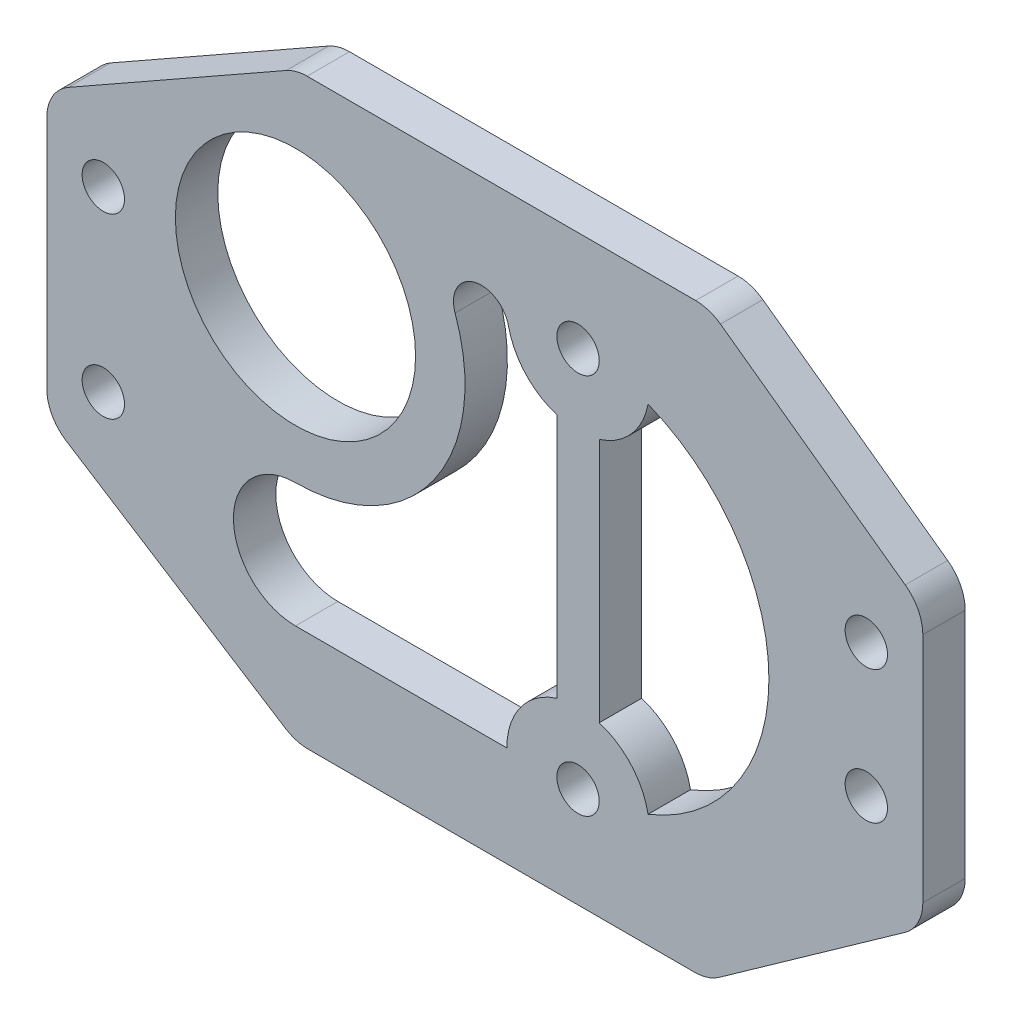
from build123d import *

# Parameters (mm, degrees)
SKETCH1_R           = 1.5
SKETCH1_R_2         = 8.5
BOSS_EXTRUDE1_DEPTH = 3


with BuildPart() as part:
    # Sketch1 → Boss-Extrude1 (new body)
    with BuildSketch(Plane.XY):
        with BuildLine():
            Line((0, 1.64796966), (0, 18.25796966))
            ThreePointArc((0, 18.25796966), (0.407702513, 19.767934474), (1.519995827, 20.867488322))
            Line((1.519995827, 20.867488322), (16.942251121, 29.614312984))
            ThreePointArc((16.942251121, 29.614312984), (17.656930521, 29.905531813), (18.422255294, 30.004794322))
            Line((18.422255294, 30.004794322), (45.922255294, 30.004794322))
            ThreePointArc((45.922255294, 30.004794322), (46.845265991, 29.859273478), (47.678731824, 29.43682849))
            Line((47.678731824, 29.43682849), (60.756476531, 19.991750808))
            ThreePointArc((60.756476531, 19.991750808), (61.671088691, 18.925471084), (62, 17.559716639))
            Line((62, 17.559716639), (62, 1.129716639))
            ThreePointArc((62, 1.129716639), (61.66533053, -0.247241299), (60.735991224, -1.316982049))
            Line((60.735991224, -1.316982049), (47.579391193, -10.651904367))
            ThreePointArc((47.579391193, -10.651904367), (46.754416966, -11.063535266), (45.84339997, -11.205205678))
            Line((45.84339997, -11.205205678), (18.50339997, -11.205205678))
            ThreePointArc((18.50339997, -11.205205678), (17.66547208, -11.085809235), (16.894241264, -10.73712358))
            Line((16.894241264, -10.73712358), (1.390841294, -0.883948242))
            ThreePointArc((1.390841294, -0.883948242), (0.370601198, 0.203579844), (0, 1.64796966))
        make_face()
        with Locations((4, 16.007488322)):
            Circle(SKETCH1_R, mode=Mode.SUBTRACT)
        with Locations((4, 3.4375)):
            Circle(SKETCH1_R, mode=Mode.SUBTRACT)
        with Locations((58, 15.091750808)):
            Circle(SKETCH1_R, mode=Mode.SUBTRACT)
        with Locations((58, 5.678289269)):
            Circle(SKETCH1_R, mode=Mode.SUBTRACT)
        with Locations((37.6, 22.899794322)):
            Circle(SKETCH1_R, mode=Mode.SUBTRACT)
        with Locations((37.6, -4.100205678)):
            Circle(SKETCH1_R, mode=Mode.SUBTRACT)
        with Locations((17.6, 16.679794322)):
            Circle(SKETCH1_R_2, mode=Mode.SUBTRACT)
        with BuildLine():
            Line((39.1, 0.713961497), (39.1, 18.085627146))
            ThreePointArc((39.1, 18.085627146), (41.365876, 19.546529711), (42.555224583, 21.966009055))
            ThreePointArc((42.555224583, 21.966009055), (51.107923726, 9.399794322), (42.555224583, -3.166420412))
            ThreePointArc((42.555224583, -3.166420412), (41.365876, -0.746941068), (39.1, 0.713961497))
        make_face(mode=Mode.SUBTRACT)
        with BuildLine():
            Line((36.1, 18.085627146), (36.1, 0.713961497))
            ThreePointArc((36.1, 0.713961497), (33.538604534, -1.111682219), (32.55755956, -4.100205678))
            Line((32.55755956, -4.100205678), (17.6, -4.100205678))
            ThreePointArc((17.6, -4.100205678), (13.21, 0.289794322), (17.6, 4.679794322))
            ThreePointArc((17.6, 4.679794322), (27.411976087, 9.771456948), (28.897406852, 20.725606777))
            ThreePointArc((28.897406852, 20.725606777), (30.206772534, 23.282822768), (32.675850225, 21.813997568))
            ThreePointArc((32.675850225, 21.813997568), (33.886159456, 19.488988843), (36.1, 18.085627146))
        make_face(mode=Mode.SUBTRACT)
    extrude(amount=BOSS_EXTRUDE1_DEPTH)


solid = part.part
